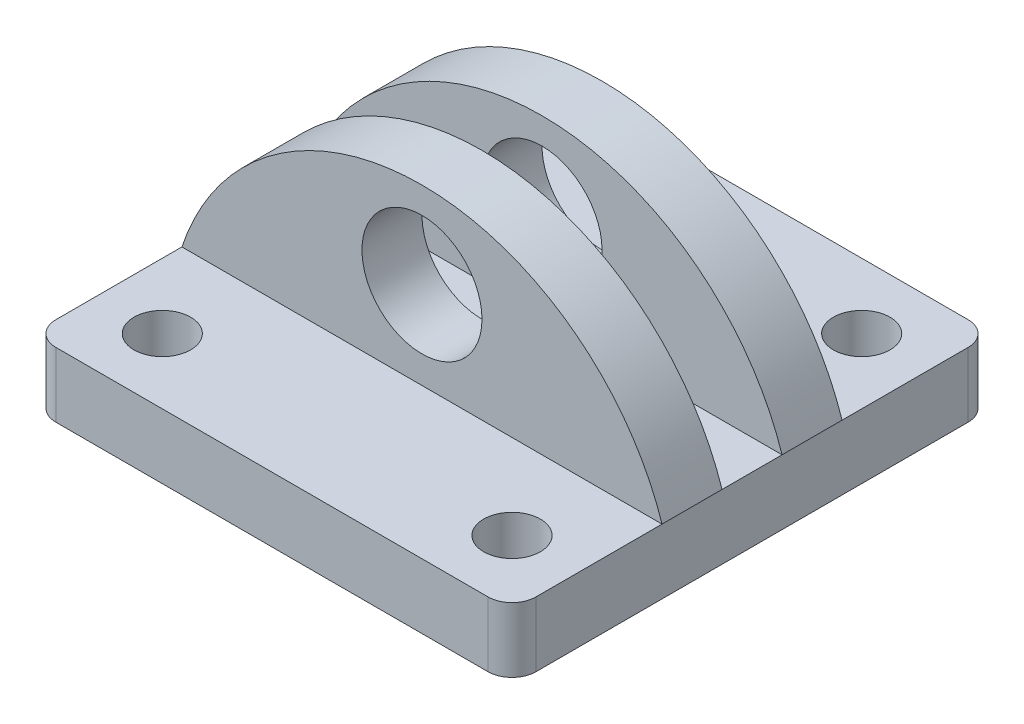
from build123d import *

# Parameters (mm, degrees)
SKETCH1_R           = 2.999994
BOSS_EXTRUDE1_DEPTH = 6.858
SKETCH2_W           = 50.8
SKETCH2_H           = 9.525
BOSS_EXTRUDE2_DEPTH = 24.892
CUT_EXTRUDE1_DEPTH  = 24.892
SKETCH4_W           = 6.35
SKETCH4_H           = 18.373928642
CUT_EXTRUDE2_DEPTH  = 58.166


with BuildPart() as part:
    # Sketch1 → Boss-Extrude1 (new body)
    with BuildSketch(Plane(origin=(0, 0, 0), x_dir=(1, 0, 0), z_dir=(0, 1, 0))):
        with BuildLine():
            Line((22.86, -25.4), (-22.86, -25.4))
            ThreePointArc((-22.86, -25.4), (-24.656051224, -24.656051224), (-25.4, -22.86))
            Line((-25.4, -22.86), (-25.4, 22.86))
            ThreePointArc((-25.4, 22.86), (-24.656051224, 24.656051224), (-22.86, 25.4))
            Line((-22.86, 25.4), (22.86, 25.4))
            ThreePointArc((22.86, 25.4), (24.656051224, 24.656051224), (25.4, 22.86))
            Line((25.4, 22.86), (25.4, -22.86))
            ThreePointArc((25.4, -22.86), (24.656051224, -24.656051224), (22.86, -25.4))
        make_face()
        with Locations(Location((-18.499963, 18.499963, 0), (0, 0, 270))):
            Circle(SKETCH1_R, mode=Mode.SUBTRACT)
        with Locations(Location((18.499963, 18.499963, 0), (0, 0, 270))):
            Circle(SKETCH1_R, mode=Mode.SUBTRACT)
        with Locations(Location((18.499963, -18.499963, 0), (0, 0, 270))):
            Circle(SKETCH1_R, mode=Mode.SUBTRACT)
        with Locations(Location((-18.499963, -18.499963, 0), (0, 0, 270))):
            Circle(SKETCH1_R, mode=Mode.SUBTRACT)
    extrude(amount=BOSS_EXTRUDE1_DEPTH)

    # Sketch2 → Boss-Extrude2 (add)
    with BuildSketch(Plane(origin=(0, 6.858, 0), x_dir=(1, 0, 0), z_dir=(0, 1, 0))):
        with Locations((0, -4.7625)):
            Rectangle(SKETCH2_W, SKETCH2_H)
        with Locations((0, 4.7625)):
            Rectangle(SKETCH2_W, SKETCH2_H)
    extrude(amount=BOSS_EXTRUDE2_DEPTH)

    # Sketch3 → Cut-Extrude1 (cut)
    with BuildSketch(Plane.XY.offset(9.525)):
        with BuildLine():
            ThreePointArc((6.35, 16.103217479), (4.490128061, 20.593345539), (0, 22.453217479))
            Line((0, 22.453217479), (0, 9.753217479))
            ThreePointArc((0, 9.753217479), (4.490128061, 11.613089418), (6.35, 16.103217479))
        make_face()
        with BuildLine():
            Line((0, 9.753217479), (0, 22.453217479))
            ThreePointArc((0, 22.453217479), (-6.35, 16.103217479), (0, 9.753217479))
        make_face()
        with BuildLine():
            Line((25.4, 31.75), (0, 31.75))
            Line((0, 31.75), (0, 25.231928642))
            ThreePointArc((0, 25.231928642), (15.674511585, 20.156909879), (25.4, 6.858))
            Line((25.4, 6.858), (25.4, 31.75))
        make_face()
        with BuildLine():
            Line((0, 25.231928642), (0, 31.75))
            Line((0, 31.75), (-25.4, 31.75))
            Line((-25.4, 31.75), (-25.4, 6.858))
            ThreePointArc((-25.4, 6.858), (-15.674511585, 20.156909879), (0, 25.231928642))
        make_face()
    extrude(amount=-CUT_EXTRUDE1_DEPTH, mode=Mode.SUBTRACT)

    # Sketch4 → Cut-Extrude2 (cut)
    with BuildSketch(Plane.ZY.offset(25.4)):
        with Locations((0, 16.044964321)):
            Rectangle(SKETCH4_W, SKETCH4_H)
    extrude(amount=-CUT_EXTRUDE2_DEPTH, mode=Mode.SUBTRACT)


solid = part.part
